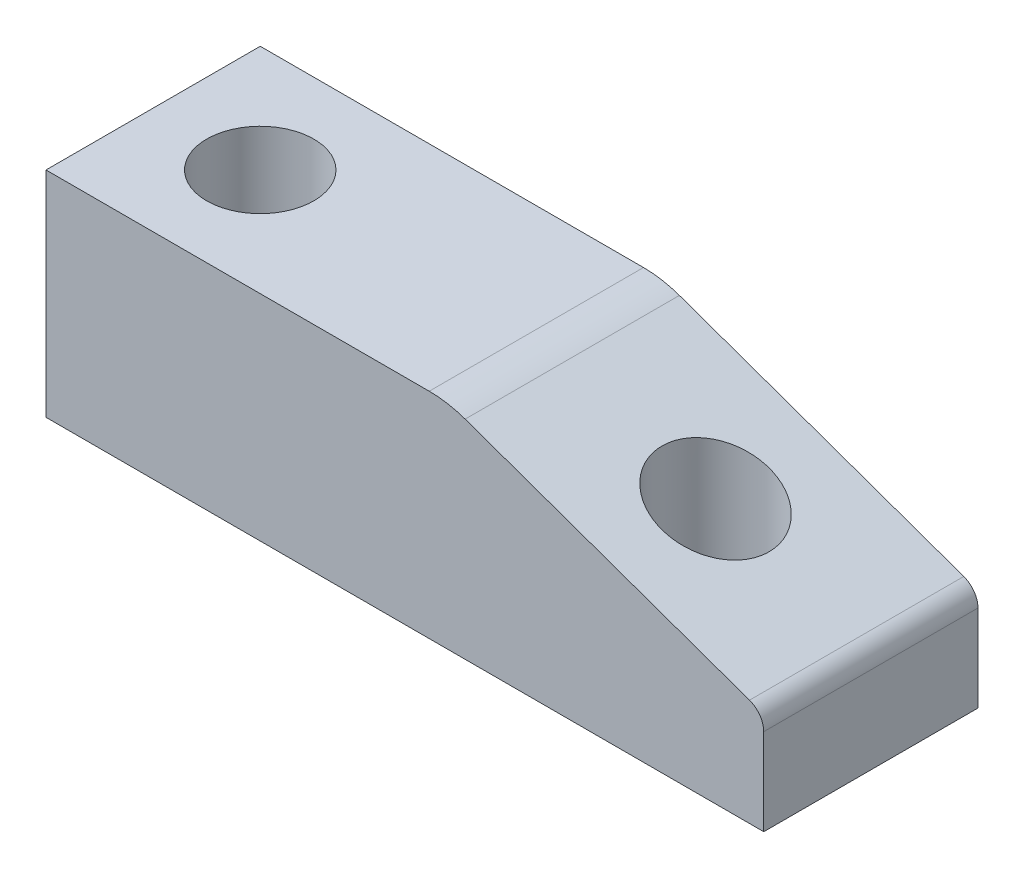
from build123d import *

# Parameters (mm, degrees)
SKETCH1_W               = 75
SKETCH1_H               = 40
SKETCH1_R               = 10
BOSS_EXTRUDE1_DEPTH     = 40
SKETCH1_4_W             = 59
SKETCH1_4_H             = 40
SKETCH1_4_R             = 10
BOSS_EXTRUDE2_DEPTH     = 40
CUT_EXTRUDE2_DEPTH      = 146.451022685
CUT_EXTRUDE2_DEPTH_BACK = 40
FILLET2_R               = 20
FILLET3_R               = 4
SKETCH1_5_R             = 10
SKETCH1_5_R_2           = 6
BOSS_EXTRUDE3_DEPTH     = 10


with BuildPart() as part:
    # Sketch1 → Boss-Extrude1 (new body)
    with BuildSketch(Plane(origin=(0, 0, 0), x_dir=(1, 0, 0), z_dir=(0, 1, 0))):
        with Locations((37.5, 20)):
            Rectangle(SKETCH1_W, SKETCH1_H)
        with Locations((20, 20)):
            Circle(SKETCH1_R, mode=Mode.SUBTRACT)
    extrude(amount=BOSS_EXTRUDE1_DEPTH)

    # Sketch1<4> → Boss-Extrude2 (add)
    with BuildSketch(Plane(origin=(0, 0, 0), x_dir=(1, 0, 0), z_dir=(0, 1, 0))):
        with Locations((104.5, 20)):
            Rectangle(SKETCH1_4_W, SKETCH1_4_H)
        with Locations((105, 20)):
            Circle(SKETCH1_4_R, mode=Mode.SUBTRACT)
    extrude(amount=BOSS_EXTRUDE2_DEPTH)

    # Sketch5 → Cut-Extrude2 (cut, two sides: drawn at the far end of the back side and taken through both)
    with BuildSketch(Plane(origin=(0, 0, -40), x_dir=(-1, 0, 0), z_dir=(0, 0, -1)).offset(-CUT_EXTRUDE2_DEPTH_BACK)):
        Polygon((-398.986226701, -75.317131538), (-134, 19), (-75, 40), (189.986226701, 134.317131538), (1.351963626, 664.289584939), (-587.620489776, 454.655321864), align=None)
    extrude(amount=CUT_EXTRUDE2_DEPTH + CUT_EXTRUDE2_DEPTH_BACK, mode=Mode.SUBTRACT)

    # Fillet2
    fillet2_edges = [part.edges().sort_by_distance(p)[0] for p in [
        (75, 40, -20),
    ]]
    fillet(fillet2_edges, radius=FILLET2_R)

    # Fillet3
    fillet3_edges = [part.edges().sort_by_distance(p)[0] for p in [
        (134, 19, -20),
    ]]
    fillet(fillet3_edges, radius=FILLET3_R)

    # Sketch1<5> → Boss-Extrude3 (add)
    # profile 1 of 2: a face of its own
    with BuildSketch(Plane(origin=(0, 0, 0), x_dir=(1, 0, 0), z_dir=(0, 1, 0))):
        with Locations((20, 20)):
            Circle(SKETCH1_5_R)
        with Locations((20, 20)):
            Circle(SKETCH1_5_R_2, mode=Mode.SUBTRACT)
    # profile 2 of 2: a face of its own
    with BuildSketch(Plane(origin=(0, 0, 0), x_dir=(1, 0, 0), z_dir=(0, 1, 0))):
        with Locations((105, 20)):
            Circle(SKETCH1_5_R)
        with Locations((105, 20)):
            Circle(SKETCH1_5_R_2, mode=Mode.SUBTRACT)
    extrude(amount=BOSS_EXTRUDE3_DEPTH)


solid = part.part
